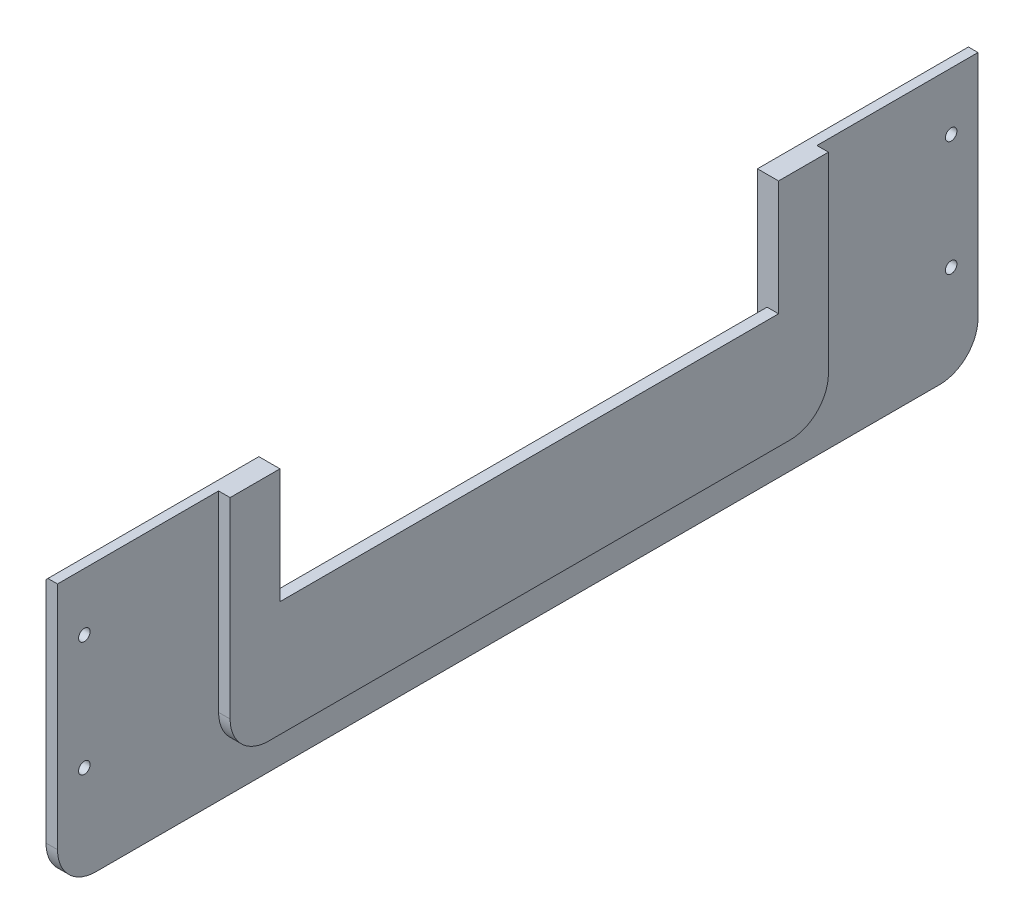
from build123d import *

# Parameters (mm, degrees)
SKETCH_1_W          = 240
SKETCH_1_H          = 70
EXTRUDE_1_DEPTH     = 3
SKETCH_4_W          = 156
SKETCH_4_H          = 60
EXTRUDE_3_DEPTH     = 3
SKETCH_5_R          = 1.5
CUT_EXTRUDE_1_DEPTH = 20
FILLET_1_R          = 10
FILLET_2_R          = 10
SKETCH_7_W          = 130
SKETCH_7_H          = 50
CUT_EXTRUDE_2_DEPTH = 3
SKETCH_8_W          = 130
SKETCH_8_H          = 30
CUT_EXTRUDE_3_DEPTH = 3
CHAMFER_1_SIZE      = 0.5
CHAMFER_2_SIZE      = 0.5


with BuildPart() as part:
    # 草图1 → 凸台-拉伸1 (new body)
    with BuildSketch(Plane(origin=(0, 0, 0), x_dir=(0, 0, -1), z_dir=(1, 0, 0))):
        with Locations((0, 10)):
            Rectangle(SKETCH_1_W, SKETCH_1_H)
    extrude(amount=EXTRUDE_1_DEPTH)

    # 草图4 → 凸台-拉伸3 (add)
    with BuildSketch(Plane(origin=(3, 0, 0), x_dir=(0, 0, -1), z_dir=(1, 0, 0))):
        with Locations((0, 15)):
            Rectangle(SKETCH_4_W, SKETCH_4_H)
    extrude(amount=EXTRUDE_3_DEPTH)

    # 草图5 → 切除-拉伸1 (cut)
    with BuildSketch(Plane.ZY):
        with Locations((113, 30)):
            Circle(SKETCH_5_R)
        with Locations((113, 0)):
            Circle(SKETCH_5_R)
        with Locations(Location((-113, 0, 0), (0, 0, 180))):
            Circle(SKETCH_5_R)
        with Locations(Location((-113, 30, 0), (0, 0, 180))):
            Circle(SKETCH_5_R)
    extrude(amount=-CUT_EXTRUDE_1_DEPTH, mode=Mode.SUBTRACT)

    # 圆角1
    fillet_1_edges = [part.edges().sort_by_distance(p)[0] for p in [
        (1.5, -25, -120),
        (1.5, -25, 120),
    ]]
    fillet(fillet_1_edges, radius=FILLET_1_R)

    # 圆角2
    fillet_2_edges = [part.edges().sort_by_distance(p)[0] for p in [
        (4.5, -15, 78),
        (4.5, -15, -78),
    ]]
    fillet(fillet_2_edges, radius=FILLET_2_R)

    # 草图7 → 切除-拉伸2 (cut)
    with BuildSketch(Plane.ZY):
        with Locations((0, 20)):
            Rectangle(SKETCH_7_W, SKETCH_7_H)
    extrude(amount=-CUT_EXTRUDE_2_DEPTH, mode=Mode.SUBTRACT)

    # 草图8 → 切除-拉伸3 (cut)
    with BuildSketch(Plane.ZY.offset(-3)):
        with Locations((0, 30)):
            Rectangle(SKETCH_8_W, SKETCH_8_H)
    extrude(amount=-CUT_EXTRUDE_3_DEPTH, mode=Mode.SUBTRACT)

    # 倒角1
    chamfer_1_edges = [part.edges().sort_by_distance(p)[0] for p in [
        (0, 45, -92.5),
        (0, 45, 92.5),
    ]]
    chamfer(chamfer_1_edges, length=CHAMFER_1_SIZE)

    # 倒角2
    chamfer_2_edges = [part.edges().sort_by_distance(p)[0] for p in [
        (0, 19.75, 65),
        (0, -5, 0),
        (0, 19.75, -65),
    ]]
    chamfer(chamfer_2_edges, length=CHAMFER_2_SIZE)


solid = part.part
